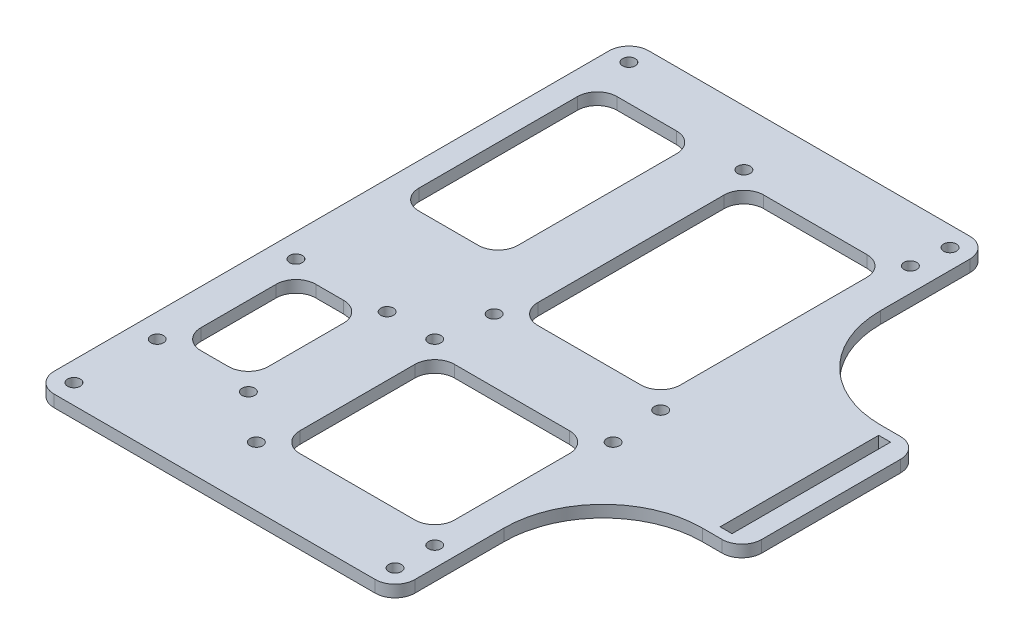
from build123d import *

# Parameters (mm, degrees)
SKETCH1_W           = 138
SKETCH1_H           = 170
BOSS_EXTRUDE1_DEPTH = 3
SKETCH2_R           = 2.1
SKETCH2_W           = 29
SKETCH2_H           = 30
CUT_EXTRUDE1_DEPTH  = 3
SKETCH3_R           = 2.1
CUT_EXTRUDE2_DEPTH  = 219.981734398
SKETCH5_W           = 29
SKETCH5_H           = 35
CUT_EXTRUDE3_DEPTH  = 219.981734398
SKETCH6_R           = 1.6
SKETCH6_W           = 3
SKETCH6_H           = 15
CUT_EXTRUDE4_DEPTH  = 219.981734398
SKETCH9_W           = 29
SKETCH9_H           = 30
BOSS_EXTRUDE2_DEPTH = 3
SKETCH15_W          = 29
SKETCH15_H          = 65
BOSS_EXTRUDE3_DEPTH = 3
SKETCH14_R          = 1.6
SKETCH14_W          = 25
SKETCH14_H          = 50
SKETCH14_W_2        = 36
SKETCH14_H_2        = 57
SKETCH14_W_3        = 39
SKETCH14_H_3        = 39
SKETCH14_W_4        = 17
SKETCH14_H_4        = 29
CUT_EXTRUDE8_DEPTH  = 219.981734398
SKETCH16_W          = 35
SKETCH16_H          = 62.5
SKETCH16_W_2        = 12
SKETCH16_H_2        = 170
CUT_EXTRUDE9_DEPTH  = 219.981734398
SKETCH17_W          = 3
SKETCH17_H          = 40
SKETCH17_W_2        = 91
SKETCH17_H_2        = 10
CUT_EXTRUDE10_DEPTH = 219.981734398
SKETCH18_W          = 10
SKETCH18_H          = 10
BOSS_EXTRUDE4_DEPTH = 3
FILLET5_R           = 5
FILLET6_R           = 25
FILLET7_R           = 5
SKETCH20_R          = 1.6
CUT_EXTRUDE11_DEPTH = 212.3125647
FILLET8_R           = 5


with BuildPart() as part:
    # Sketch1 → Boss-Extrude1 (new body)
    with BuildSketch(Plane(origin=(0, 0, 0), x_dir=(1, 0, 0), z_dir=(0, 1, 0))):
        with Locations((69, 85)):
            Rectangle(SKETCH1_W, SKETCH1_H)
    extrude(amount=BOSS_EXTRUDE1_DEPTH)

    # Sketch2 → Cut-Extrude1 (cut)
    with BuildSketch(Plane(origin=(0, 3, 0), x_dir=(1, 0, 0), z_dir=(0, 1, 0))):
        with Locations(Location((69, 165, 0), (0, 0, 270))):
            Circle(SKETCH2_R)
        with Locations(Location((69, 5, 0), (0, 0, 270))):
            Circle(SKETCH2_R)
        with Locations((14.5, 155)):
            Rectangle(SKETCH2_W, SKETCH2_H)
        with Locations((123.5, 155)):
            Rectangle(SKETCH2_W, SKETCH2_H)
        with Locations((123.5, 15)):
            Rectangle(SKETCH2_W, SKETCH2_H)
        with Locations((14.5, 15)):
            Rectangle(SKETCH2_W, SKETCH2_H)
    extrude(amount=-CUT_EXTRUDE1_DEPTH, mode=Mode.SUBTRACT)

    # Sketch3 → Cut-Extrude2 (cut, through all)
    with BuildSketch(Plane(origin=(0, 3, 0), x_dir=(1, 0, 0), z_dir=(0, 1, 0))):
        with Locations(Location((14, 125, 0), (0, 0, 270))):
            Circle(SKETCH3_R)
        with Locations(Location((14, 45, 0), (0, 0, 270))):
            Circle(SKETCH3_R)
        with Locations(Location((14, 85, 0), (0, 0, 270))):
            Circle(SKETCH3_R)
        with Locations(Location((124, 45, 0), (0, 0, 90))):
            Circle(SKETCH3_R)
        with Locations(Location((124, 125, 0), (0, 0, 90))):
            Circle(SKETCH3_R)
    extrude(amount=-CUT_EXTRUDE2_DEPTH, mode=Mode.SUBTRACT)

    # Sketch5 → Cut-Extrude3 (cut, through all)
    with BuildSketch(Plane(origin=(0, 3, 0), x_dir=(1, 0, 0), z_dir=(0, 1, 0))):
        with Locations((14.5, 122.5)):
            Rectangle(SKETCH5_W, SKETCH5_H)
        with Locations((14.5, 47.5)):
            Rectangle(SKETCH5_W, SKETCH5_H)
    extrude(amount=-CUT_EXTRUDE3_DEPTH, mode=Mode.SUBTRACT)

    # Sketch6 → Cut-Extrude4 (cut, through all)
    with BuildSketch(Plane(origin=(0, 3, 0), x_dir=(1, 0, 0), z_dir=(0, 1, 0))):
        with Locations(Location((131.5, 113, 0), (0, 0, 270))):
            Circle(SKETCH6_R)
        with Locations(Location((131.5, 57, 0), (0, 0, 270))):
            Circle(SKETCH6_R)
        with Locations((131.5, 97.5)):
            Rectangle(SKETCH6_W, SKETCH6_H)
        with Locations((131.5, 72.5)):
            Rectangle(SKETCH6_W, SKETCH6_H)
    extrude(amount=-CUT_EXTRUDE4_DEPTH, mode=Mode.SUBTRACT)

    # Sketch9 → Boss-Extrude2 (add)
    with BuildSketch(Plane(origin=(0, 3, 0), x_dir=(1, 0, 0), z_dir=(0, 1, 0))):
        with Locations((123.5, 155)):
            Rectangle(SKETCH9_W, SKETCH9_H)
        with Locations((123.5, 15)):
            Rectangle(SKETCH9_W, SKETCH9_H)
    extrude(amount=-BOSS_EXTRUDE2_DEPTH)

    # Sketch15 → Boss-Extrude3 (add)
    with BuildSketch(Plane(origin=(0, 3, 0), x_dir=(1, 0, 0), z_dir=(0, 1, 0))):
        with Locations((14.5, 137.5)):
            Rectangle(SKETCH15_W, SKETCH15_H)
        with Locations((14.5, 32.5)):
            Rectangle(SKETCH15_W, SKETCH15_H)
    extrude(amount=-BOSS_EXTRUDE3_DEPTH)

    # Sketch14 → Cut-Extrude8 (cut, through all)
    with BuildSketch(Plane(origin=(0, 3, 0), x_dir=(1, 0, 0), z_dir=(0, 1, 0))):
        with Locations(Location((55, 146, 0), (0, 0, 270))):
            Circle(SKETCH14_R)
        with Locations(Location((97, 146, 0), (0, 0, 270))):
            Circle(SKETCH14_R)
        with Locations(Location((55, 83, 0), (0, 0, 270))):
            Circle(SKETCH14_R)
        with Locations(Location((97, 83, 0), (0, 0, 270))):
            Circle(SKETCH14_R)
        with Locations(Location((53, 70, 0), (0, 0, 270))):
            Circle(SKETCH14_R)
        with Locations(Location((98, 70, 0), (0, 0, 270))):
            Circle(SKETCH14_R)
        with Locations(Location((53, 25, 0), (0, 0, 270))):
            Circle(SKETCH14_R)
        with Locations(Location((98, 25, 0), (0, 0, 270))):
            Circle(SKETCH14_R)
        with Locations(Location((41, 70, 0), (0, 0, 270))):
            Circle(SKETCH14_R)
        with Locations(Location((18, 70, 0), (0, 0, 270))):
            Circle(SKETCH14_R)
        with Locations(Location((18, 35, 0), (0, 0, 270))):
            Circle(SKETCH14_R)
        with Locations(Location((41, 35, 0), (0, 0, 270))):
            Circle(SKETCH14_R)
        with Locations((30.5, 121)):
            Rectangle(SKETCH14_W, SKETCH14_H)
        with Locations((76, 114.5)):
            Rectangle(SKETCH14_W_2, SKETCH14_H_2)
        with Locations((75.5, 47.5)):
            Rectangle(SKETCH14_W_3, SKETCH14_H_3)
        with Locations((29.5, 52.5)):
            Rectangle(SKETCH14_W_4, SKETCH14_H_4)
    extrude(amount=-CUT_EXTRUDE8_DEPTH, mode=Mode.SUBTRACT)

    # Sketch16 → Cut-Extrude9 (cut, through all)
    with BuildSketch(Plane(origin=(0, 3, 0), x_dir=(1, 0, 0), z_dir=(0, 1, 0))):
        with Locations((120.5, 138.75)):
            Rectangle(SKETCH16_W, SKETCH16_H)
        with Locations((120.5, 31.25)):
            Rectangle(SKETCH16_W, SKETCH16_H)
        with Locations((6, 85)):
            Rectangle(SKETCH16_W_2, SKETCH16_H_2)
    extrude(amount=-CUT_EXTRUDE9_DEPTH, mode=Mode.SUBTRACT)

    # Sketch17 → Cut-Extrude10 (cut, through all)
    with BuildSketch(Plane(origin=(0, 3, 0), x_dir=(1, 0, 0), z_dir=(0, 1, 0))):
        with Locations((131.5, 85)):
            Rectangle(SKETCH17_W, SKETCH17_H)
        with Locations((57.5, 165)):
            Rectangle(SKETCH17_W_2, SKETCH17_H_2)
        with Locations((57.5, 5)):
            Rectangle(SKETCH17_W_2, SKETCH17_H_2)
    extrude(amount=-CUT_EXTRUDE10_DEPTH, mode=Mode.SUBTRACT)

    # Sketch18 → Boss-Extrude4 (add)
    with BuildSketch(Plane(origin=(0, 3, 0), x_dir=(1, 0, 0), z_dir=(0, 1, 0))):
        with Locations((17, 85)):
            Rectangle(SKETCH18_W, SKETCH18_H)
    extrude(amount=-BOSS_EXTRUDE4_DEPTH)

    # Fillet5
    fillet5_edges = [part.edges().sort_by_distance(p)[0] for p in [
        (138, 1.5, -62.5),
        (138, 1.5, -107.5),
        (12, 1.5, -160),
        (103, 1.5, -160),
        (12, 1.5, -10),
        (103, 1.5, -10),
    ]]
    fillet(fillet5_edges, radius=FILLET5_R)

    # Fillet6
    fillet6_edges = [part.edges().sort_by_distance(p)[0] for p in [
        (103, 1.5, -62.5),
        (103, 1.5, -107.5),
    ]]
    fillet(fillet6_edges, radius=FILLET6_R)

    # Fillet7
    fillet7_edges = [part.edges().sort_by_distance(p)[0] for p in [
        (18, 1.5, -96),
        (18, 1.5, -146),
        (43, 1.5, -146),
        (43, 1.5, -96),
    ]]
    fillet(fillet7_edges, radius=FILLET7_R)

    # Sketch20 → Cut-Extrude11 (cut, through all)
    with BuildSketch(Plane(origin=(0, 3, 0), x_dir=(1, 0, 0), z_dir=(0, 1, 0))):
        with Locations(Location((17, 155, 0), (0, 0, 270))):
            Circle(SKETCH20_R)
        with Locations(Location((98, 155, 0), (0, 0, 270))):
            Circle(SKETCH20_R)
        with Locations(Location((17, 15, 0), (0, 0, 270))):
            Circle(SKETCH20_R)
        with Locations(Location((98, 15, 0), (0, 0, 270))):
            Circle(SKETCH20_R)
    extrude(amount=-CUT_EXTRUDE11_DEPTH, mode=Mode.SUBTRACT)

    # Fillet8
    fillet8_edges = [part.edges().sort_by_distance(p)[0] for p in [
        (56, 1.5, -28),
        (56, 1.5, -67),
        (95, 1.5, -67),
        (95, 1.5, -28),
        (38, 1.5, -38),
        (21, 1.5, -38),
        (21, 1.5, -67),
        (38, 1.5, -67),
        (58, 1.5, -86),
        (58, 1.5, -143),
        (94, 1.5, -143),
        (94, 1.5, -86),
    ]]
    fillet(fillet8_edges, radius=FILLET8_R)


solid = part.part
